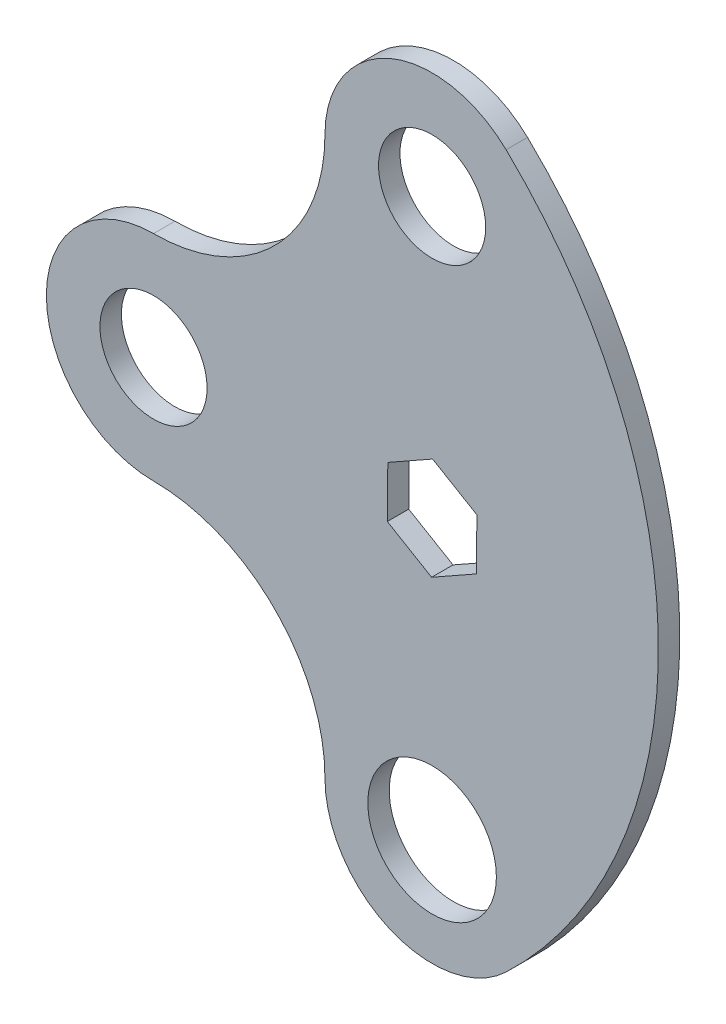
from build123d import *

# Parameters (mm, degrees)
SKETCH2_R           = 12.5
SKETCH2_R_2         = 15
BOSS_EXTRUDE1_DEPTH = 5


with BuildPart() as part:
    # Sketch2 → Boss-Extrude1 (new body)
    with BuildSketch(Plane.XY):
        with BuildLine():
            ThreePointArc((0, 25), (-25, 0), (0, -25))
            ThreePointArc((0, -25), (28.284271247, -36.715728753), (40, -65))
            ThreePointArc((40, -65), (55.168868326, -87.985840207), (82.267908001, -83.078145737))
            ThreePointArc((82.267908001, -83.078145737), (117.800748333, 0), (82.267908001, 83.078145737))
            ThreePointArc((82.267908001, 83.078145737), (55.168868326, 87.985840207), (40, 65))
            ThreePointArc((40, 65), (28.284271247, 36.715728753), (0, 25))
        make_face()
        Circle(SKETCH2_R, mode=Mode.SUBTRACT)
        with Locations((65, 65)):
            Circle(SKETCH2_R, mode=Mode.SUBTRACT)
        with Locations((65, -65)):
            Circle(SKETCH2_R_2, mode=Mode.SUBTRACT)
        Polygon((75.334929147, -6.098298085), (75.448745635, 5.901162145), (65.113816488, 11.99946023), (54.665070853, 6.098298085), (54.551254365, -5.901162145), (64.886183512, -11.99946023), align=None, mode=Mode.SUBTRACT)
    extrude(amount=BOSS_EXTRUDE1_DEPTH)


solid = part.part
